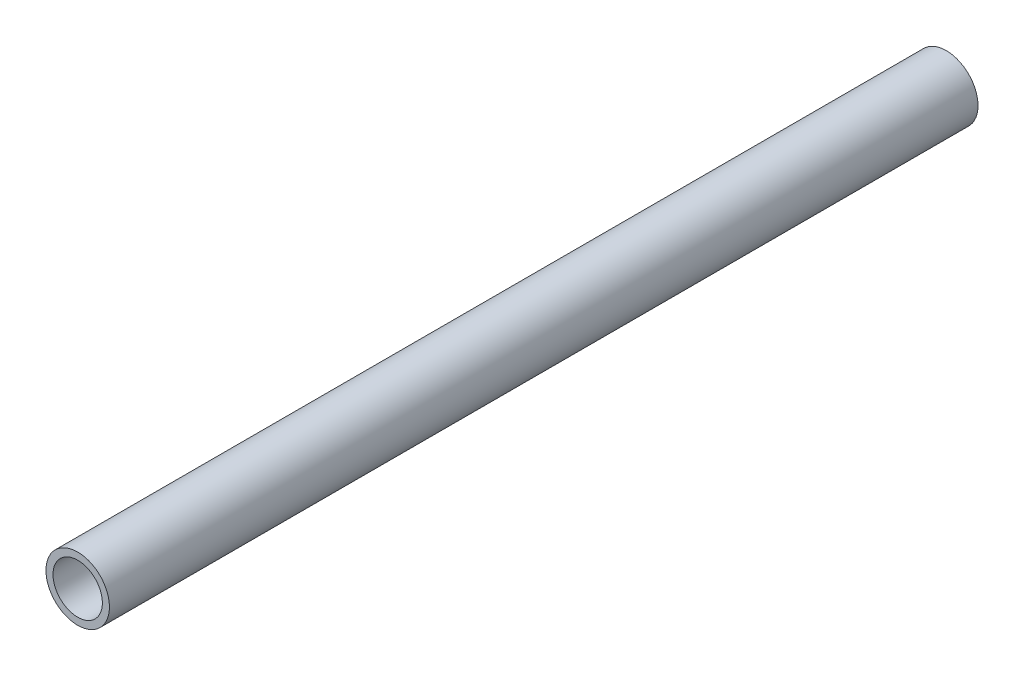
from build123d import *

# Parameters (mm, degrees)
SKETCH1_R           = 9
SKETCH1_R_2         = 7
BOSS_EXTRUDE1_DEPTH = 246.188


with BuildPart() as part:
    # Sketch1 → Boss-Extrude1 (new body)
    with BuildSketch(Plane.XY):
        Circle(SKETCH1_R)
        Circle(SKETCH1_R_2, mode=Mode.SUBTRACT)
    extrude(amount=BOSS_EXTRUDE1_DEPTH)


solid = part.part
